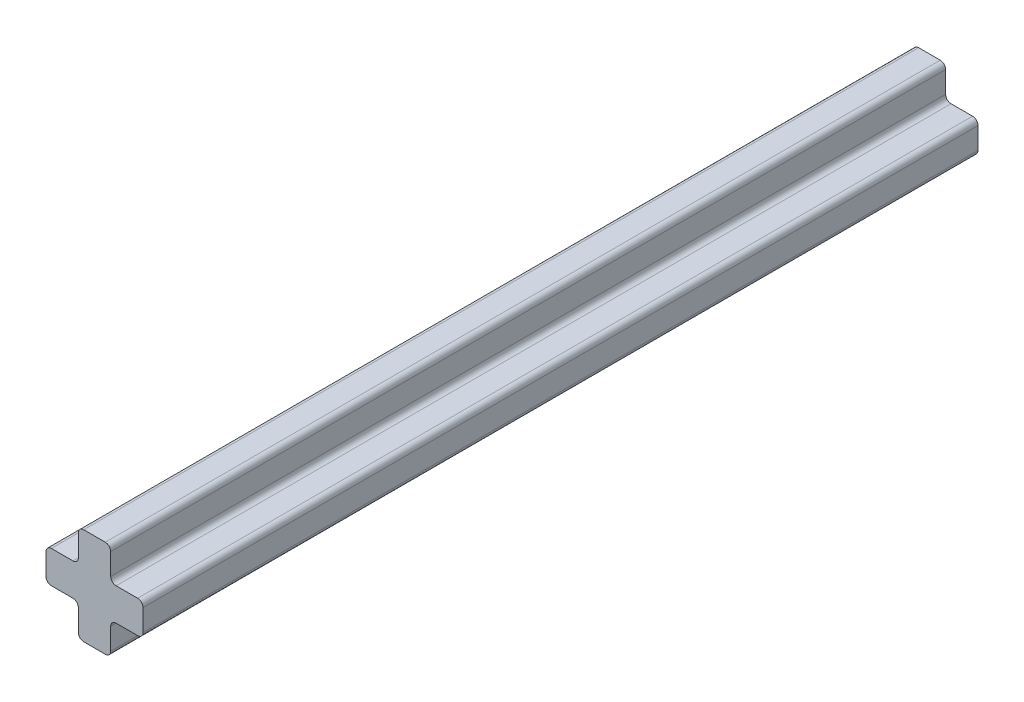
from build123d import *

# Parameters (mm, degrees)
EXTRUDE1_DEPTH = 39.325


with BuildPart() as part:
    # Sketch1 → Extrude1 (new body)
    with BuildSketch(Plane.XY):
        with BuildLine():
            Line((-0.762, 2.032), (-0.762, 1.016))
            ThreePointArc((-0.762, 1.016), (-0.836394878, 0.836394878), (-1.016, 0.762))
            Line((-1.016, 0.762), (-2.032, 0.762))
            ThreePointArc((-2.032, 0.762), (-2.211605122, 0.687605122), (-2.286, 0.508))
            Line((-2.286, 0.508), (-2.286, -0.508))
            ThreePointArc((-2.286, -0.508), (-2.211605122, -0.687605122), (-2.032, -0.762))
            Line((-2.032, -0.762), (-1.016, -0.762))
            ThreePointArc((-1.016, -0.762), (-0.836394878, -0.836394878), (-0.762, -1.016))
            Line((-0.762, -1.016), (-0.762, -2.032))
            ThreePointArc((-0.762, -2.032), (-0.687605122, -2.211605122), (-0.508, -2.286))
            Line((-0.508, -2.286), (0.508, -2.286))
            ThreePointArc((0.508, -2.286), (0.687605122, -2.211605122), (0.762, -2.032))
            Line((0.762, -2.032), (0.762, -1.016))
            ThreePointArc((0.762, -1.016), (0.836394878, -0.836394878), (1.016, -0.762))
            Line((1.016, -0.762), (2.032, -0.762))
            ThreePointArc((2.032, -0.762), (2.211605122, -0.687605122), (2.286, -0.508))
            Line((2.286, -0.508), (2.286, 0.508))
            ThreePointArc((2.286, 0.508), (2.211605122, 0.687605122), (2.032, 0.762))
            Line((2.032, 0.762), (1.016, 0.762))
            ThreePointArc((1.016, 0.762), (0.836394878, 0.836394878), (0.762, 1.016))
            Line((0.762, 1.016), (0.762, 2.032))
            ThreePointArc((0.762, 2.032), (0.687605122, 2.211605122), (0.508, 2.286))
            Line((0.508, 2.286), (-0.508, 2.286))
            ThreePointArc((-0.508, 2.286), (-0.687605122, 2.211605122), (-0.762, 2.032))
        make_face()
    extrude(amount=EXTRUDE1_DEPTH)


solid = part.part
